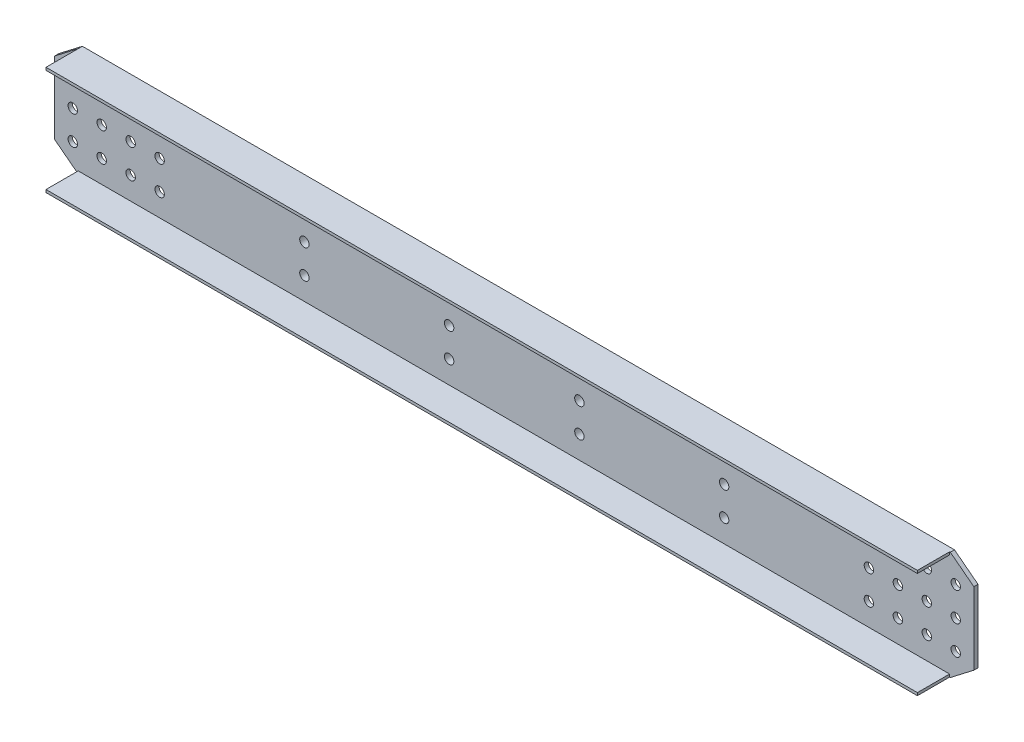
from build123d import *

# Parameters (mm, degrees)
SKETCH_1_R          = 13
EXTRUDE_789_DEPTH   = 11.5
SKETCH_2_W          = 2408.049034164
SKETCH_2_H          = 7.5
EXTRUDE_1_DEPTH     = 89
SKETCH_3_W          = 80
SKETCH_3_H          = 240
EXTRUDE_2_DEPTH     = 16
SKETCH_4_R          = 13
CUT_EXTRUDE_1_DEPTH = 1308.983562588


with BuildPart() as part:
    # 草图1 → Extrude 789 (new body)
    with BuildSketch(Plane.XY):
        Polygon((-1205, 0), (1205, 0), (1270, 50), (1270, 250), (1205, 300), (-1205, 300), (-1270, 250), (-1270, 50), align=None)
        with Locations((-1220, 230)):
            Circle(SKETCH_1_R, mode=Mode.SUBTRACT)
        with Locations((-1220, 150)):
            Circle(SKETCH_1_R, mode=Mode.SUBTRACT)
        with Locations((-1140, 230)):
            Circle(SKETCH_1_R, mode=Mode.SUBTRACT)
        with Locations((-1140, 150)):
            Circle(SKETCH_1_R, mode=Mode.SUBTRACT)
        with Locations((-1060, 230)):
            Circle(SKETCH_1_R, mode=Mode.SUBTRACT)
        with Locations((-1060, 150)):
            Circle(SKETCH_1_R, mode=Mode.SUBTRACT)
        with Locations((-980, 150)):
            Circle(SKETCH_1_R, mode=Mode.SUBTRACT)
        with Locations(Location((-1060, 70, 0), (0, 0, 180))):
            Circle(SKETCH_1_R, mode=Mode.SUBTRACT)
        with Locations(Location((-1140, 70, 0), (0, 0, 180))):
            Circle(SKETCH_1_R, mode=Mode.SUBTRACT)
        with Locations(Location((-1220, 70, 0), (0, 0, 180))):
            Circle(SKETCH_1_R, mode=Mode.SUBTRACT)
        with Locations((1220, 70)):
            Circle(SKETCH_1_R, mode=Mode.SUBTRACT)
        with Locations((1140, 70)):
            Circle(SKETCH_1_R, mode=Mode.SUBTRACT)
        with Locations((1060, 70)):
            Circle(SKETCH_1_R, mode=Mode.SUBTRACT)
        with Locations(Location((980, 150, 0), (0, 0, 180))):
            Circle(SKETCH_1_R, mode=Mode.SUBTRACT)
        with Locations(Location((1060, 150, 0), (0, 0, 180))):
            Circle(SKETCH_1_R, mode=Mode.SUBTRACT)
        with Locations(Location((1060, 230, 0), (0, 0, 180))):
            Circle(SKETCH_1_R, mode=Mode.SUBTRACT)
        with Locations(Location((1140, 150, 0), (0, 0, 180))):
            Circle(SKETCH_1_R, mode=Mode.SUBTRACT)
        with Locations(Location((1140, 230, 0), (0, 0, 180))):
            Circle(SKETCH_1_R, mode=Mode.SUBTRACT)
        with Locations(Location((1220, 150, 0), (0, 0, 180))):
            Circle(SKETCH_1_R, mode=Mode.SUBTRACT)
        with Locations(Location((1220, 230, 0), (0, 0, 180))):
            Circle(SKETCH_1_R, mode=Mode.SUBTRACT)
        with Locations((-980, 70)):
            Circle(SKETCH_1_R, mode=Mode.SUBTRACT)
        with Locations((-980, 230)):
            Circle(SKETCH_1_R, mode=Mode.SUBTRACT)
        with Locations((980, 70)):
            Circle(SKETCH_1_R, mode=Mode.SUBTRACT)
        with Locations((980, 230)):
            Circle(SKETCH_1_R, mode=Mode.SUBTRACT)
    extrude(amount=-EXTRUDE_789_DEPTH)

    # 草图2 → 凸台-拉伸1 (add)
    with BuildSketch(Plane.XY):
        with Locations((-0.975482918, 296.25)):
            Rectangle(SKETCH_2_W, SKETCH_2_H)
        with Locations((-0.975482918, 3.75)):
            Rectangle(SKETCH_2_W, SKETCH_2_H)
    extrude(amount=EXTRUDE_1_DEPTH)

    # 草图3 → 凸台-拉伸2 (add)
    with BuildSketch(Plane(origin=(0, 0, -11.5), x_dir=(-1, 0, 0), z_dir=(0, 0, -1))):
        with Locations((-580, 150)):
            Rectangle(SKETCH_3_W, SKETCH_3_H)
        with Locations((-180, 150)):
            Rectangle(SKETCH_3_W, SKETCH_3_H)
        with Locations((180, 150)):
            Rectangle(SKETCH_3_W, SKETCH_3_H)
        with Locations((580, 150)):
            Rectangle(SKETCH_3_W, SKETCH_3_H)
    extrude(amount=EXTRUDE_2_DEPTH)

    # 草图4 → 切除-拉伸1 (cut, through all)
    with BuildSketch(Plane.XY):
        with Locations((-580, 230)):
            Circle(SKETCH_4_R)
        with Locations((-580, 150)):
            Circle(SKETCH_4_R)
        with Locations((-180, 230)):
            Circle(SKETCH_4_R)
        with Locations((-180, 150)):
            Circle(SKETCH_4_R)
        with Locations(Location((-180, 70, 0), (0, 0, 180))):
            Circle(SKETCH_4_R)
        with Locations(Location((-580, 70, 0), (0, 0, 180))):
            Circle(SKETCH_4_R)
        with Locations((580, 70)):
            Circle(SKETCH_4_R)
        with Locations((180, 70)):
            Circle(SKETCH_4_R)
        with Locations(Location((180, 150, 0), (0, 0, 180))):
            Circle(SKETCH_4_R)
        with Locations(Location((180, 230, 0), (0, 0, 180))):
            Circle(SKETCH_4_R)
        with Locations(Location((580, 150, 0), (0, 0, 180))):
            Circle(SKETCH_4_R)
        with Locations(Location((580, 230, 0), (0, 0, 180))):
            Circle(SKETCH_4_R)
    extrude(amount=-CUT_EXTRUDE_1_DEPTH, mode=Mode.SUBTRACT)


solid = part.part
